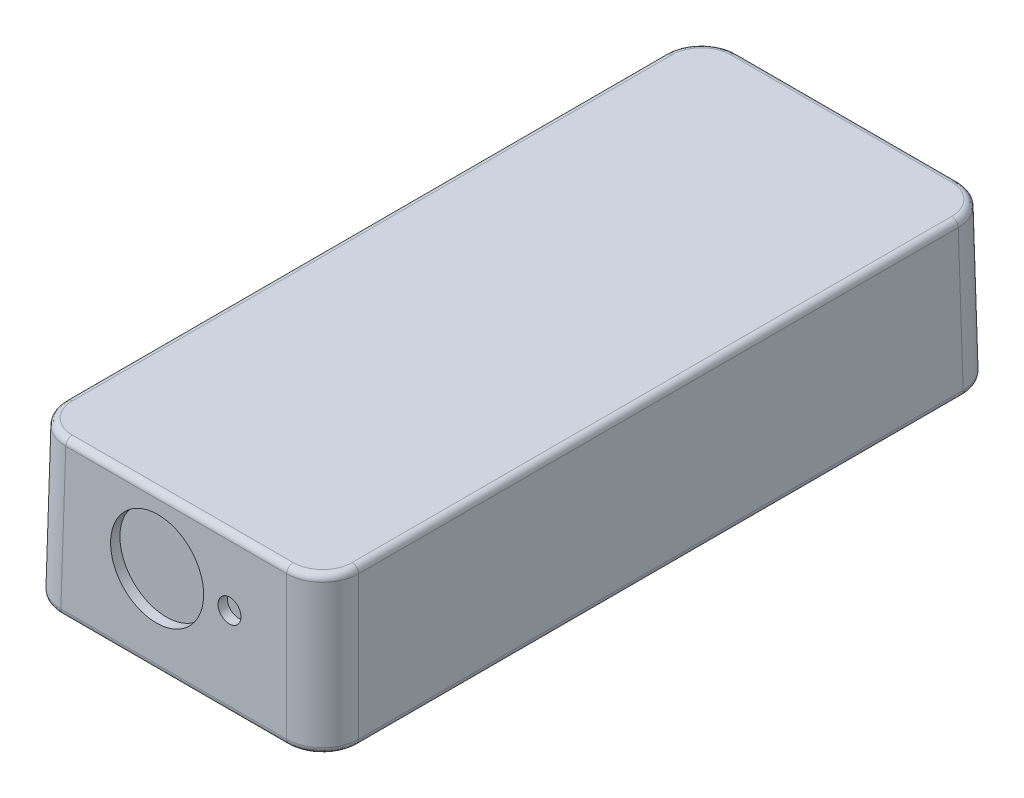
from build123d import *

# Parameters (mm, degrees)
SKETCH_1_W          = 45.5
SKETCH_1_H          = 103.3
EXTRUDE_1_DEPTH     = 23.5
EXTRUDE_1_TAPER     = 1
FILLET_1_R          = 5.5
CUT_EXTRUDE_START   = 50
SKETCH_2_R          = 1.75
SKETCH_2_R_2        = 7.1
CUT_EXTRUDE_1_DEPTH = 12.135382714
FILLET_2_R          = 1


with BuildPart() as part:
    # 草图1 → 凸台-拉伸1 (new body)
    with BuildSketch(Plane(origin=(0, 0, 0), x_dir=(1, 0, 0), z_dir=(0, 1, 0))):
        Rectangle(SKETCH_1_W, SKETCH_1_H)
    extrude(amount=EXTRUDE_1_DEPTH, taper=EXTRUDE_1_TAPER)

    # 圆角1
    fillet_1_edges = [part.edges().sort_by_distance(p)[0] for p in [
        (-22.544902987, 11.75, -51.444902987),
        (22.544902987, 11.75, -51.444902987),
        (22.544902987, 11.75, 51.444902987),
        (-22.544902987, 11.75, 51.444902987),
    ]]
    fillet(fillet_1_edges, radius=FILLET_1_R)

    # 草图2 → 切除-拉伸1 (cut, through all)
    with BuildSketch(Plane.XY.offset(CUT_EXTRUDE_START)):
        with Locations(Location((8.294902987, 13.45, 0), (0, 0, 90))):
            Circle(SKETCH_2_R)
        with Locations(Location((-2.755097013, 13.45, 0), (0, 0, 90))):
            Circle(SKETCH_2_R_2)
    extrude(amount=CUT_EXTRUDE_1_DEPTH, mode=Mode.SUBTRACT)

    # 圆角2
    fillet_2_edges = [part.edges().sort_by_distance(p)[0] for p in [
        (-22.75, 0, 0),
        (-22.339805974, 23.5, 0),
        (0, 0, -51.65),
        (22.75, 0, 0),
        (0, 0, 51.65),
        (21.13943429, 0, 50.039434183),
        (-21.13943429, 0, 50.039434183),
        (21.13943429, 0, -50.039434183),
        (-21.139434183, 0, -50.03943429),
        (0, 23.5, -51.239805974),
        (0, 23.5, 51.239805974),
        (22.339805974, 23.5, 0),
        (20.729240264, 23.5, 49.629240157),
        (-20.729240264, 23.5, 49.629240157),
        (20.729240264, 23.5, -49.629240157),
        (-20.729240157, 23.5, -49.629240264),
    ]]
    fillet(fillet_2_edges, radius=FILLET_2_R)


solid = part.part
